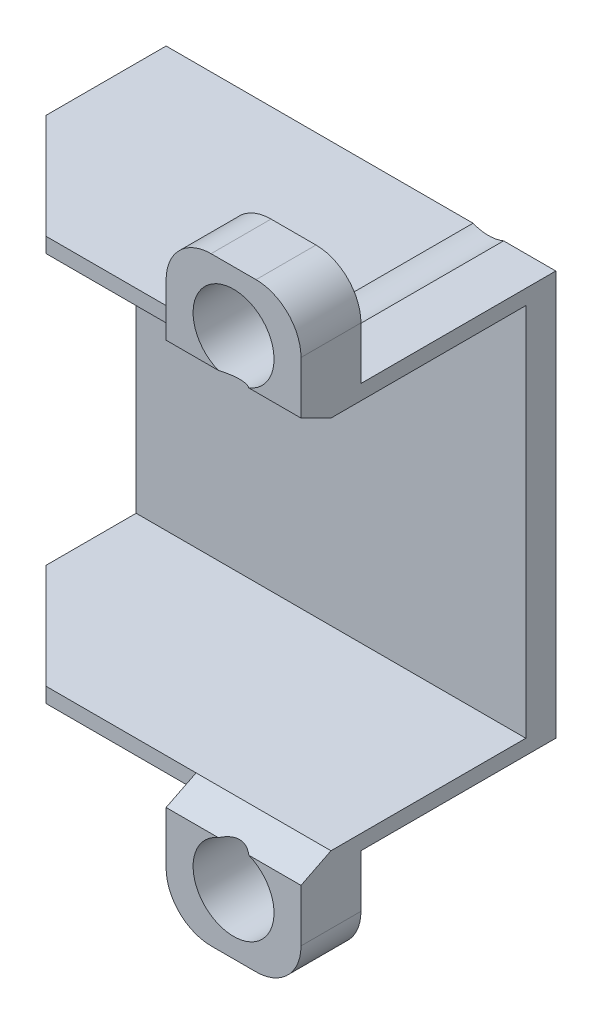
from build123d import *

# Parameters (mm, degrees)
CROQUIS1_W              = 26
CROQUIS1_H              = 27
SALIENTE_EXTRUIR1_DEPTH = 2
CROQUIS2_W              = 26
CROQUIS2_H              = 1
SALIENTE_EXTRUIR2_DEPTH = 13
SALIENTE_EXTRUIR3_DEPTH = 9
CROQUIS5_R              = 2.7
CORTAR_EXTRUIR1_DEPTH   = 17
REDONDEO1_R             = 3
CORTAR_EXTRUIR2_START   = -27
CORTAR_EXTRUIR2_DEPTH   = 27


with BuildPart() as part:
    # Croquis1 → Saliente-Extruir1 (new body)
    with BuildSketch(Plane.XY):
        with Locations((-26.399771714, -2.880068531)):
            Rectangle(CROQUIS1_W, CROQUIS1_H)
    extrude(amount=SALIENTE_EXTRUIR1_DEPTH)

    # Croquis2 → Saliente-Extruir2 (add)
    with BuildSketch(Plane.XY.offset(2)):
        with Locations((-26.399771714, 10.119931469)):
            Rectangle(CROQUIS2_W, CROQUIS2_H)
        with Locations((-26.399771714, -15.880068531)):
            Rectangle(CROQUIS2_W, CROQUIS2_H)
    extrude(amount=SALIENTE_EXTRUIR2_DEPTH)

    # Croquis3 → Saliente-Extruir3 (add)
    with BuildSketch(Plane(origin=(-13.399771714, 0, 0), x_dir=(0, 0, -1), z_dir=(1, 0, 0))):
        Polygon((-17, -16.380068531), (-15, -15.380068531), (-15, -16.380068531), (-13, -16.380068531), (-13, -22.880068531), (-15, -22.880068531), (-17, -22.880068531), align=None)
        Polygon((-15, 10.619931469), (-13, 10.619931469), (-13, 17.119931469), (-15, 17.119931469), (-17, 17.119931469), (-17, 10.619931469), (-15, 9.619931469), align=None)
    extrude(amount=-SALIENTE_EXTRUIR3_DEPTH)

    # Croquis5 → Cortar-Extruir1 (cut)
    with BuildSketch(Plane.XY.offset(17)):
        with Locations(Location((-17.899771714, -18.880068531, 0), (0, 0, 67.808393434))):
            Circle(CROQUIS5_R)
        with Locations(Location((-17.899771714, 13.119931469, 0), (0, 0, 292.191606566))):
            Circle(CROQUIS5_R)
    extrude(amount=-CORTAR_EXTRUIR1_DEPTH, mode=Mode.SUBTRACT)

    # Redondeo1
    redondeo1_edges = [part.edges().sort_by_distance(p)[0] for p in [
        (-22.399771714, -22.880068531, 15),
        (-13.399771714, -22.880068531, 15),
        (-22.399771714, 17.119931469, 15),
        (-13.399771714, 17.119931469, 15),
    ]]
    fillet(redondeo1_edges, radius=REDONDEO1_R)

    # Croquis6 → Cortar-Extruir2 (cut)
    with BuildSketch(Plane.XZ.offset(16.380068531).offset(CORTAR_EXTRUIR2_START)):
        Polygon((-39.399771714, 15), (-39.399771714, 8), (-32.399771714, 15), align=None)
    extrude(amount=CORTAR_EXTRUIR2_DEPTH, mode=Mode.SUBTRACT)


solid = part.part
